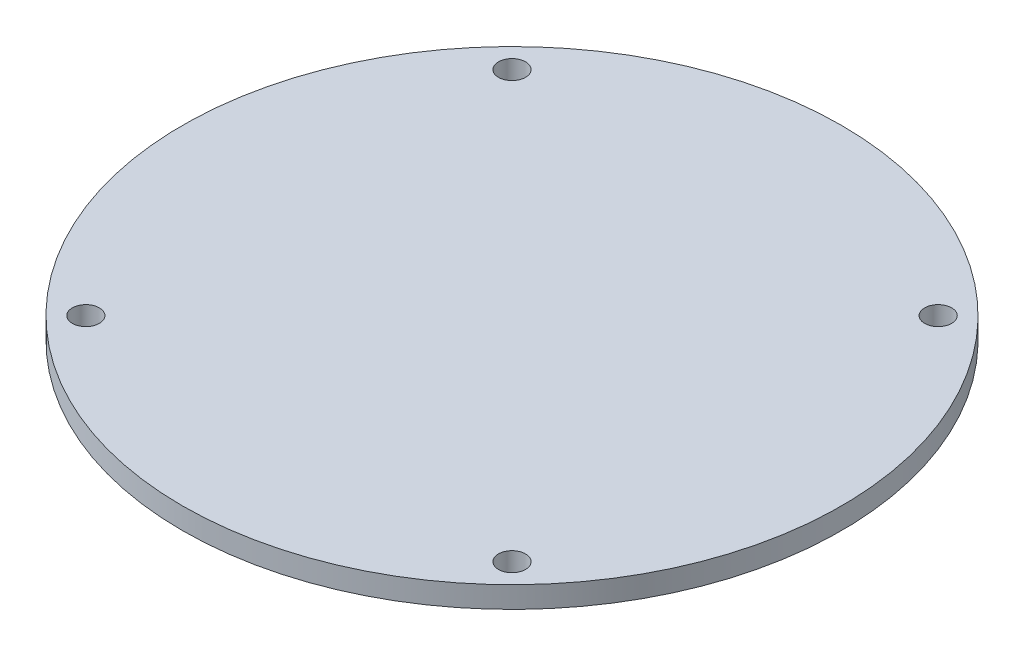
from build123d import *

# Parameters (mm, degrees)
SKETCH1_R           = 25
SKETCH1_R_2         = 1.025
BOSS_EXTRUDE1_DEPTH = 1.6256


with BuildPart() as part:
    # Sketch1 → Boss-Extrude1 (new body)
    with BuildSketch(Plane(origin=(0, 0, 0), x_dir=(1, 0, 0), z_dir=(0, 1, 0))):
        with Locations(Location((0, 0, 0), (0, 0, 270))):
            Circle(SKETCH1_R)
        with Locations(Location((16.164461018, 16.164461018, 0), (0, 0, 270))):
            Circle(SKETCH1_R_2, mode=Mode.SUBTRACT)
        with Locations(Location((16.164461018, -16.164461018, 0), (0, 0, 270))):
            Circle(SKETCH1_R_2, mode=Mode.SUBTRACT)
        with Locations(Location((-16.164461018, -16.164461018, 0), (0, 0, 270))):
            Circle(SKETCH1_R_2, mode=Mode.SUBTRACT)
        with Locations(Location((-16.164461018, 16.164461018, 0), (0, 0, 270))):
            Circle(SKETCH1_R_2, mode=Mode.SUBTRACT)
    extrude(amount=BOSS_EXTRUDE1_DEPTH)


solid = part.part
